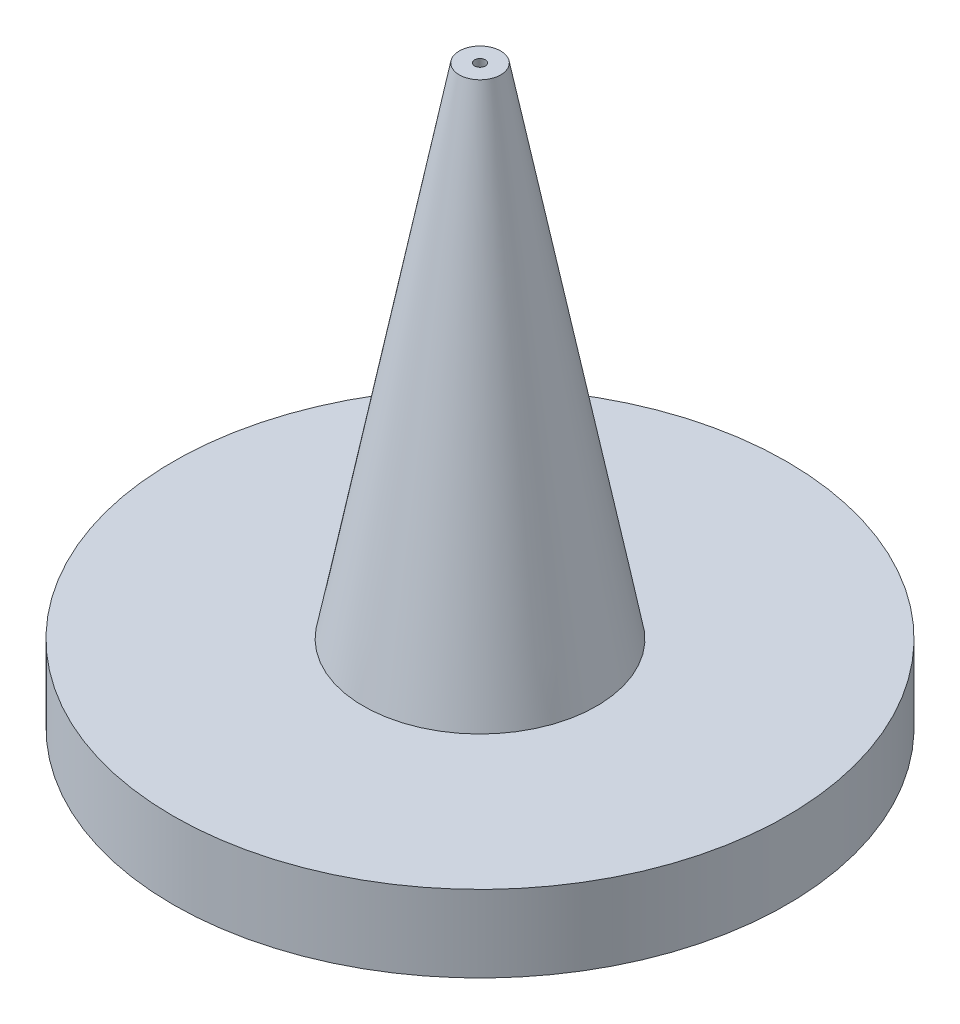
from build123d import *


with BuildPart() as part:
    # Sketch1 → Revolve1 (revolve)
    with BuildSketch(Plane.XY, mode=Mode.PRIVATE) as revolve1_sk:
        Polygon((10.16, 0), (10.16, 2.54), (3.8608, 2.54), (0.6858, 19.05), (0.1778, 19.05), (3.3528, 0), align=None)
    revolve(revolve1_sk.sketch.rotate(Axis((0, 0, 0), (0, 1, 0)), 90), axis=Axis((0, 0, 0), (0, 1, 0)))


solid = part.part
